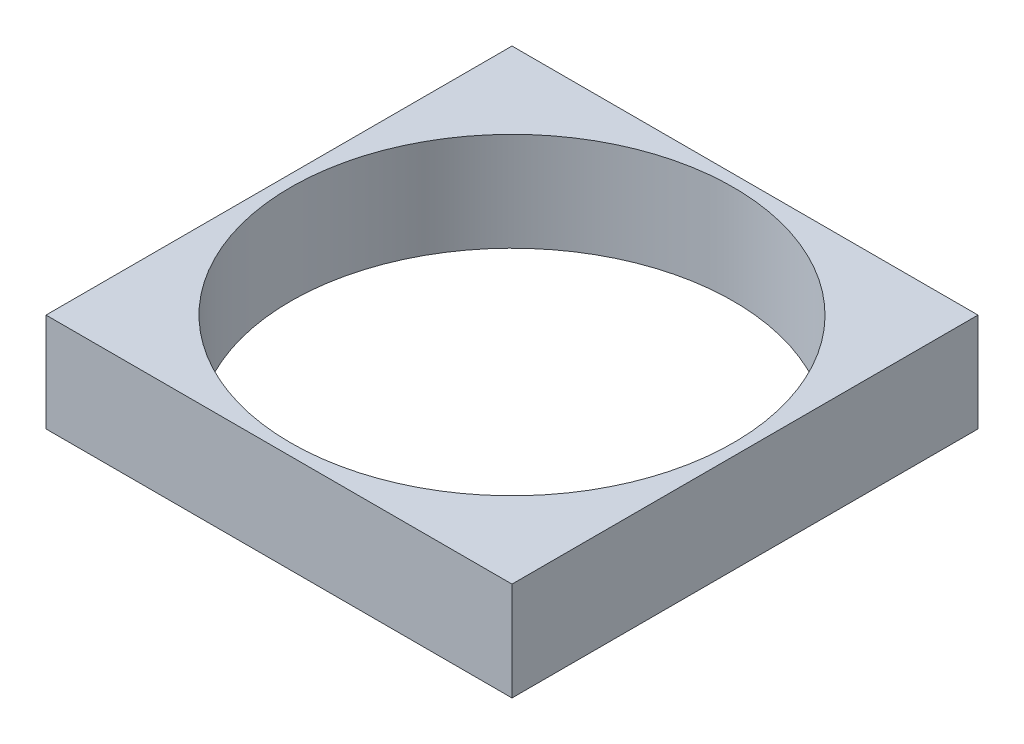
from build123d import *

# Parameters (mm, degrees)
SKETCH2_W           = 120
SKETCH2_H           = 120
SKETCH2_R           = 57
BOSS_EXTRUDE1_DEPTH = 25.4


with BuildPart() as part:
    # Sketch2 → Boss-Extrude1 (new body)
    with BuildSketch(Plane(origin=(0, 0, 0), x_dir=(1, 0, 0), z_dir=(0, 1, 0))):
        Rectangle(SKETCH2_W, SKETCH2_H)
        with Locations(Location((0, 0, 0), (0, 0, 270))):
            Circle(SKETCH2_R, mode=Mode.SUBTRACT)
    extrude(amount=BOSS_EXTRUDE1_DEPTH)


solid = part.part
